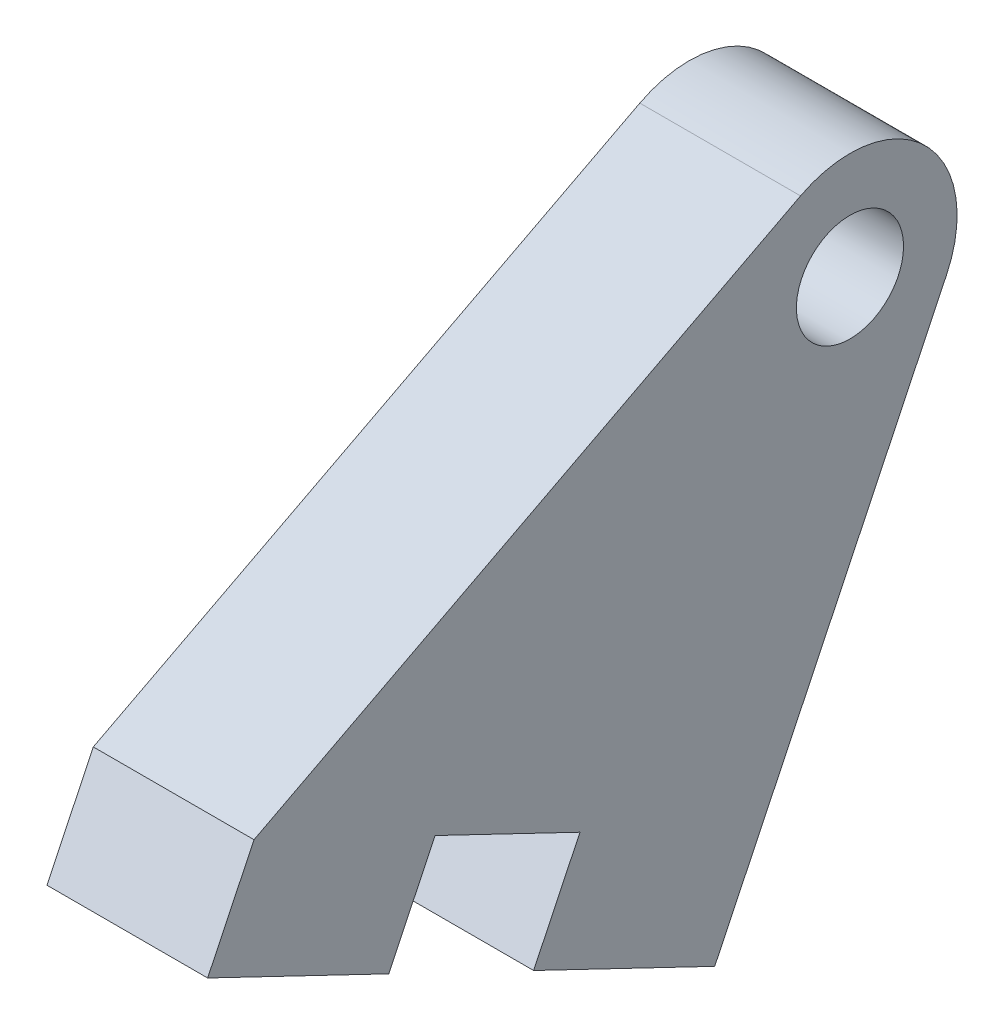
from build123d import *

# Parameters (mm, degrees)
SKETCH1_R           = 0.5
BOSS_EXTRUDE1_DEPTH = 1.5


with BuildPart() as part:
    # Sketch1 → Boss-Extrude1 (new body)
    with BuildSketch(Plane(origin=(0, 0, 0), x_dir=(0, 0, -1), z_dir=(1, 0, 0))):
        with BuildLine():
            Line((-97.427906133, 3.051254101), (-95.263862375, 7.558682926))
            ThreePointArc((-95.263862375, 7.558682926), (-95.469674877, 8.709850021), (-96.626851501, 8.878630138))
            Line((-96.626851501, 8.878630138), (-101.727897648, 6.224985812))
            Line((-101.727897648, 6.224985812), (-102.1607064, 5.323500047))
            Line((-102.1607064, 5.323500047), (-100.47042059, 4.511983637))
            Line((-100.47042059, 4.511983637), (-100.037611839, 5.413469402))
            Line((-100.037611839, 5.413469402), (-98.685383191, 4.764256275))
            Line((-98.685383191, 4.764256275), (-99.118191943, 3.86277051))
            Line((-99.118191943, 3.86277051), (-97.427906133, 3.051254101))
        make_face()
        with Locations((-96.16534814, 7.991491677)):
            Circle(SKETCH1_R, mode=Mode.SUBTRACT)
    extrude(amount=BOSS_EXTRUDE1_DEPTH)


solid = part.part
